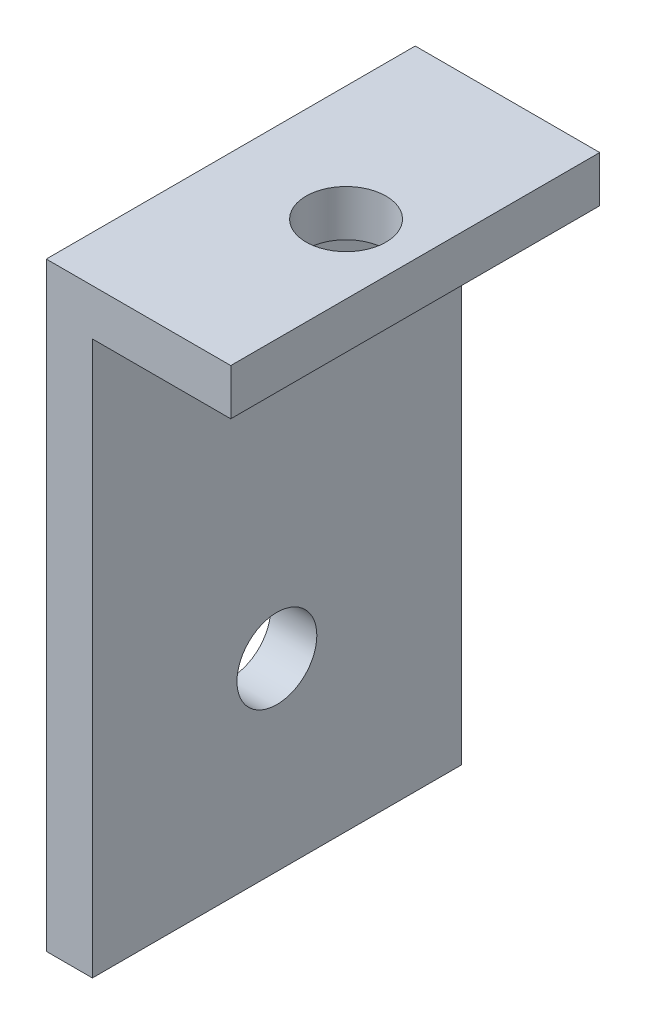
from build123d import *

# Parameters (mm, degrees)
BOSS_EXTRUDE1_DEPTH  = 25.4
M5_CLEARANCE_HOLE1_D = 5.5
M5_CLEARANCE_HOLE2_D = 5.5


with BuildPart() as part:
    # Sketch2 → Boss-Extrude1 (new body)
    with BuildSketch(Plane.XY):
        Polygon((0, 0), (0, 41.275), (12.7, 41.275), (12.7, 38.1), (3.175, 38.1), (3.175, 0), align=None)
    extrude(amount=BOSS_EXTRUDE1_DEPTH)

    # M5 Clearance Hole1 (through all)
    with Locations(Plane(origin=(0, 38.1, 0), x_dir=(-1, 0, 0), z_dir=(0, -1, 0))):
        with Locations((-7.9375, -12.7)):
            Hole(M5_CLEARANCE_HOLE1_D / 2)

    # M5 Clearance Hole2 (through all)
    with Locations(Plane(origin=(3.175, 0, 0), x_dir=(0, 0, -1), z_dir=(1, 0, 0))):
        with Locations((-12.7, 12.7)):
            Hole(M5_CLEARANCE_HOLE2_D / 2)


solid = part.part
